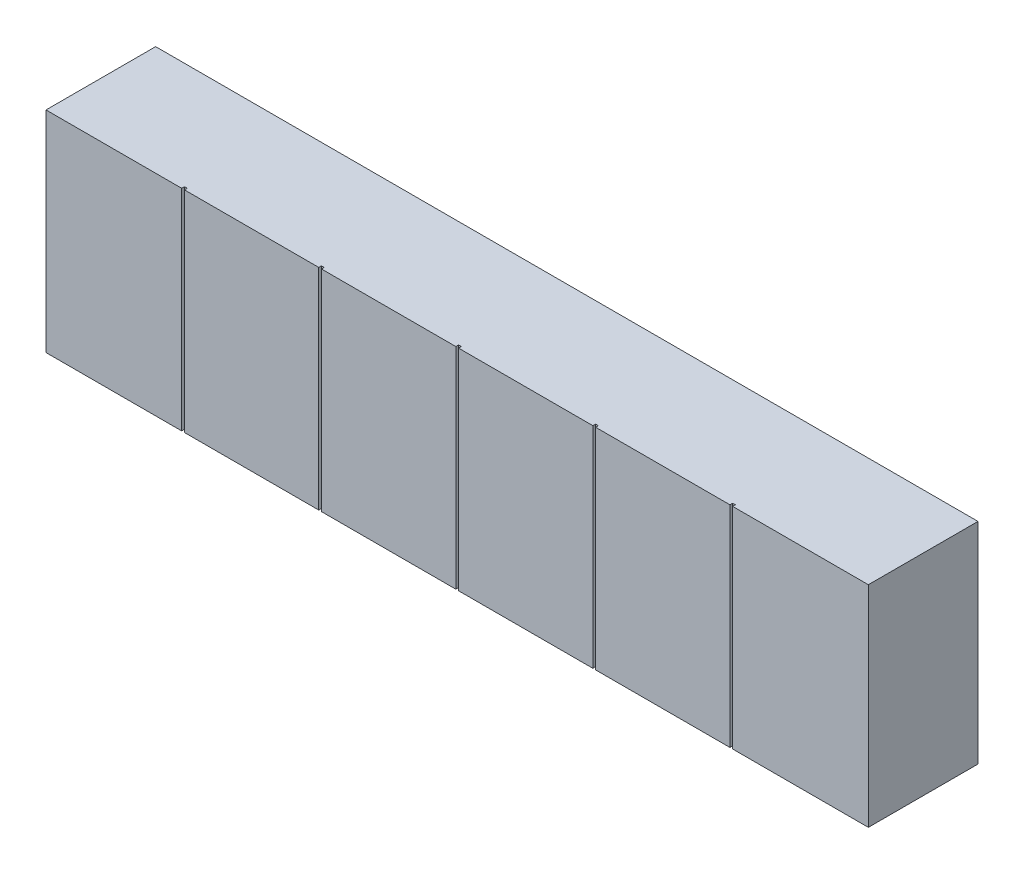
from build123d import *

# Parameters (mm, degrees)
SKETCH1_W           = 900
SKETCH1_H           = 230
BOSS_EXTRUDE1_DEPTH = 120
SKETCH2_W           = 3
SKETCH2_H           = 230
CUT_EXTRUDE1_DEPTH  = 3


with BuildPart() as part:
    # Sketch1 → Boss-Extrude1 (new body)
    with BuildSketch(Plane.XY):
        Rectangle(SKETCH1_W, SKETCH1_H)
    extrude(amount=BOSS_EXTRUDE1_DEPTH)

    # Sketch2 → Cut-Extrude1 (cut)
    with BuildSketch(Plane.XY.offset(120)):
        with Locations((-300, 0)):
            Rectangle(SKETCH2_W, SKETCH2_H)
        with Locations((-150, 0)):
            Rectangle(SKETCH2_W, SKETCH2_H)
        Rectangle(SKETCH2_W, SKETCH2_H)
        with Locations((150, 0)):
            Rectangle(SKETCH2_W, SKETCH2_H)
        with Locations((300, 0)):
            Rectangle(SKETCH2_W, SKETCH2_H)
    extrude(amount=-CUT_EXTRUDE1_DEPTH, mode=Mode.SUBTRACT)


solid = part.part
